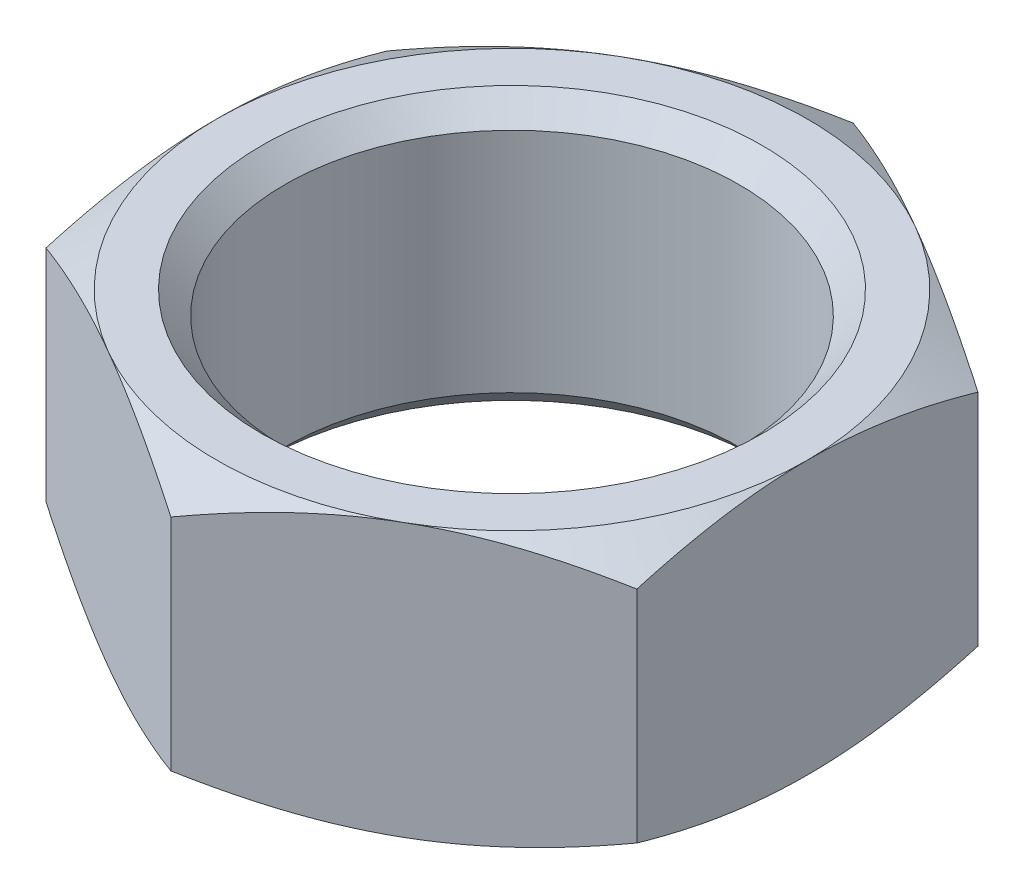
from build123d import *

# Parameters (mm, degrees)
BOSS_EXTRUDE1_DEPTH     = 6
SKETCH2_OUTSIDE_W       = 77.868
SKETCH2_OUTSIDE_H       = 81.89
SKETCH2_OUTSIDE_R       = 13
CUT_EXTRUDE1_DEPTH      = 12
CUT_EXTRUDE1_DRAFT      = -60
MIRROR1_COPY_1_SKETCH_W = 77.868
MIRROR1_COPY_1_SKETCH_H = 81.89
MIRROR1_COPY_1_SKETCH_R = 13
MIRROR1_COPY_1_DEPTH    = 12
MIRROR1_COPY_1_DRAFT    = -60
SKETCH3_R               = 10
CUT_EXTRUDE2_DEPTH      = 24.202011407
CHAMFER1_SIZE           = 1


with BuildPart() as part:
    # Sketch1 → Boss-Extrude1 (new, symmetric)
    with BuildSketch(Plane(origin=(0, 0, 0), x_dir=(1, 0, 0), z_dir=(0, 1, 0))):
        Polygon((13, 7.505553499), (0, 15.011106999), (-13, 7.505553499), (-13, -7.505553499), (0, -15.011106999), (13, -7.505553499), align=None)
    extrude(amount=BOSS_EXTRUDE1_DEPTH, both=True)


with BuildPart() as cut_extrude1_tool:
    # Sketch2 outside → Cut-Extrude1 (with draft: the straight prism first)
    with BuildSketch(Plane(origin=(0, 6, 0), x_dir=(1, 0, 0), z_dir=(0, 1, 0))):
        Rectangle(SKETCH2_OUTSIDE_W, SKETCH2_OUTSIDE_H)
        Circle(SKETCH2_OUTSIDE_R, mode=Mode.SUBTRACT)
    extrude(amount=-CUT_EXTRUDE1_DEPTH)
    # Cut-Extrude1: the draft: its side faces are tilted about the plane it starts from
    cut_extrude1_sides = [cut_extrude1_tool.faces().sort_by_distance(p)[0] for p in [
        (0, 0, 40.945),
        (38.934, 0, 0),
        (0, 0, -40.945),
        (-38.934, 0, 0),
        (-13, 0, 0),
    ]]
    draft(cut_extrude1_sides, Plane(origin=(0, 6, 0), x_dir=(1, 0, 0), z_dir=(0, 1, 0)), CUT_EXTRUDE1_DRAFT)


with BuildPart() as part_1:
    add(part.part)

    # Cut-Extrude1: cut by cut_extrude1_tool
    add(cut_extrude1_tool.part, mode=Mode.SUBTRACT)


with BuildPart() as mirror1_copy_1_tool:
    # Mirror1 copy 1 sketch → Mirror1 copy 1 (with draft: the straight prism first)
    with BuildSketch(Plane.XZ.offset(6)):
        Rectangle(MIRROR1_COPY_1_SKETCH_W, MIRROR1_COPY_1_SKETCH_H)
        Circle(MIRROR1_COPY_1_SKETCH_R, mode=Mode.SUBTRACT)
    extrude(amount=-MIRROR1_COPY_1_DEPTH)
    # Mirror1 copy 1: the draft: its side faces are tilted about the plane it starts from
    mirror1_copy_1_sides = [mirror1_copy_1_tool.faces().sort_by_distance(p)[0] for p in [
        (0, 0, 40.945),
        (38.934, 0, 0),
        (0, 0, -40.945),
        (-38.934, 0, 0),
        (-13, 0, 0),
    ]]
    draft(mirror1_copy_1_sides, Plane.XZ.offset(6), MIRROR1_COPY_1_DRAFT)


with BuildPart() as part_2:
    add(part_1.part)

    # Mirror1 copy 1: cut by mirror1_copy_1_tool
    add(mirror1_copy_1_tool.part, mode=Mode.SUBTRACT)

    # Sketch3 → Cut-Extrude2 (cut, through all)
    with BuildSketch(Plane(origin=(0, 6, 0), x_dir=(1, 0, 0), z_dir=(0, 1, 0))):
        with Locations(Location((0, 0, 0), (0, 0, 270))):
            Circle(SKETCH3_R)
    extrude(amount=-CUT_EXTRUDE2_DEPTH, mode=Mode.SUBTRACT)

    # Chamfer1
    chamfer1_edges = [part_2.edges().sort_by_distance(p)[0] for p in [
        (0, -6, -10),
        (0, 6, -10),
    ]]
    chamfer(chamfer1_edges, length=CHAMFER1_SIZE)


solid = part_2.part
